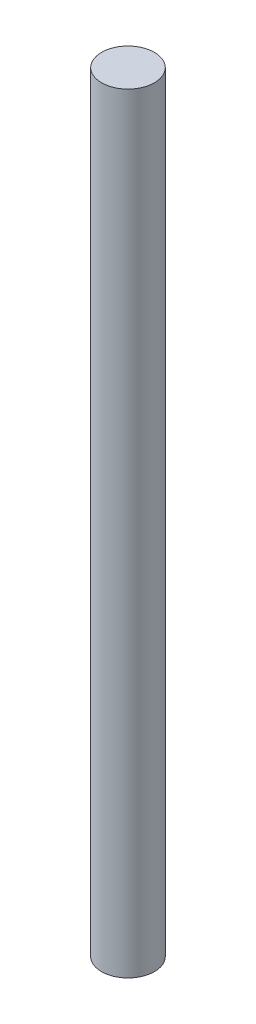
from build123d import *

# Parameters (mm, degrees)
CROQUIS1_R              = 6
SALIENTE_EXTRUIR1_DEPTH = 87.5


with BuildPart() as part:
    # Croquis1 → Saliente-Extruir1 (new, symmetric)
    with BuildSketch(Plane(origin=(0, 0, 0), x_dir=(1, 0, 0), z_dir=(0, 1, 0))):
        with Locations(Location((0, 0, 0), (0, 0, 270))):
            Circle(CROQUIS1_R)
    extrude(amount=SALIENTE_EXTRUIR1_DEPTH, both=True)


solid = part.part
